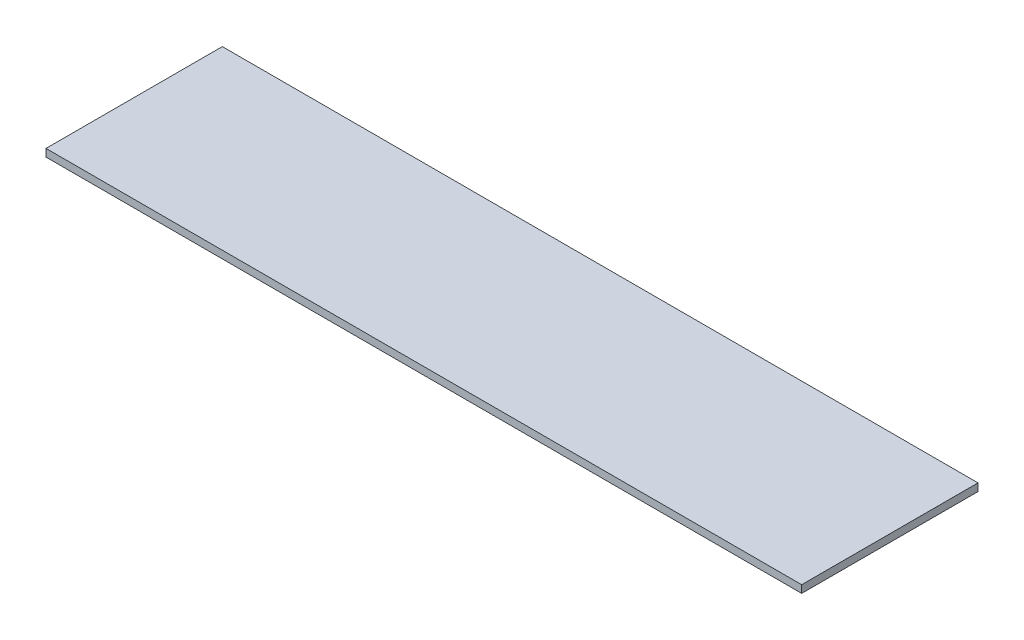
from build123d import *

# Parameters (mm, degrees)
SKETCH1_W           = 3000
SKETCH1_H           = 700
BOSS_EXTRUDE1_DEPTH = 30


with BuildPart() as part:
    # Sketch1 → Boss-Extrude1 (new body)
    with BuildSketch(Plane(origin=(0, 0, 0), x_dir=(1, 0, 0), z_dir=(0, 1, 0))):
        Rectangle(SKETCH1_W, SKETCH1_H)
    extrude(amount=BOSS_EXTRUDE1_DEPTH)


solid = part.part
